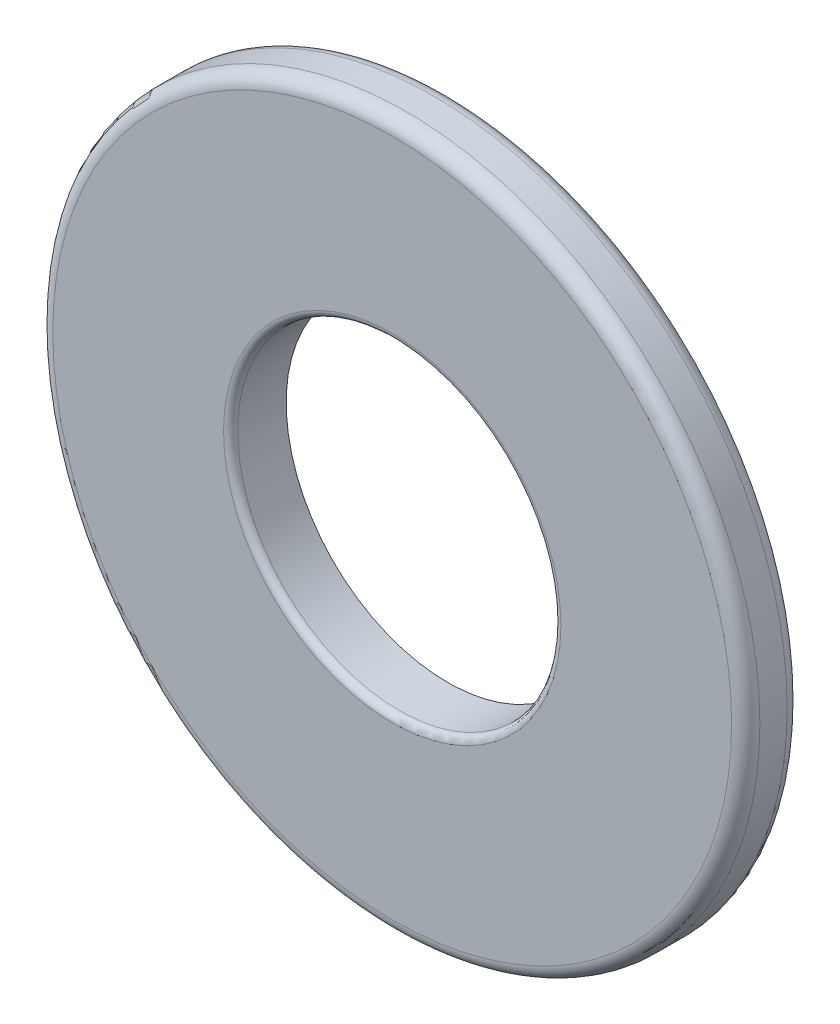
from build123d import *

# Parameters (mm, degrees)
BOSS_EXTRUDE1_DEPTH      = 0.275
BOSS_EXTRUDE1_DEPTH_BACK = 0.275
SKETCH3_R                = 3.5
SKETCH3_R_2              = 1.6
FILLET1_R                = 0.14
FILLET2_R                = 0.07


with BuildPart() as part:
    # Sketch3 → Boss-Extrude1 (new, two sides: drawn at the far end of the back side and taken through both)
    with BuildSketch(Plane.XY.offset(-BOSS_EXTRUDE1_DEPTH_BACK)):
        Circle(SKETCH3_R)
        Circle(SKETCH3_R_2, mode=Mode.SUBTRACT)
    extrude(amount=BOSS_EXTRUDE1_DEPTH + BOSS_EXTRUDE1_DEPTH_BACK)

    # Fillet1
    fillet1_edges = [part.edges().sort_by_distance(p)[0] for p in [
        (-3.5, 0, -0.275),
        (-3.5, 0, 0.275),
    ]]
    fillet(fillet1_edges, radius=FILLET1_R)

    # Fillet2
    fillet2_edges = [part.edges().sort_by_distance(p)[0] for p in [
        (-1.6, 0, 0.275),
    ]]
    fillet(fillet2_edges, radius=FILLET2_R)


solid = part.part
